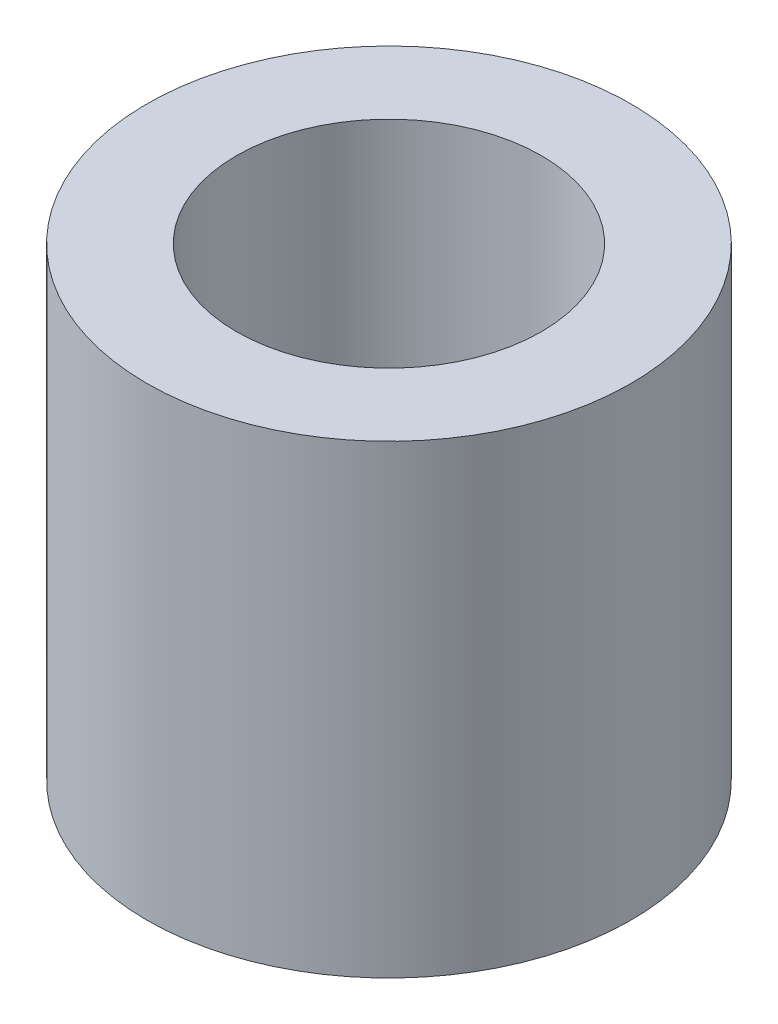
from build123d import *

# Parameters (mm, degrees)
SKETCH1_R           = 3.175
SKETCH1_R_2         = 2
BOSS_EXTRUDE1_DEPTH = 6.096


with BuildPart() as part:
    # Sketch1 → Boss-Extrude1 (new body)
    with BuildSketch(Plane(origin=(0, 0, 0), x_dir=(1, 0, 0), z_dir=(0, 1, 0))):
        with Locations(Location((0, 0, 0), (0, 0, 270))):
            Circle(SKETCH1_R)
        with Locations(Location((0, 0, 0), (0, 0, 270))):
            Circle(SKETCH1_R_2, mode=Mode.SUBTRACT)
    extrude(amount=-BOSS_EXTRUDE1_DEPTH)


solid = part.part
